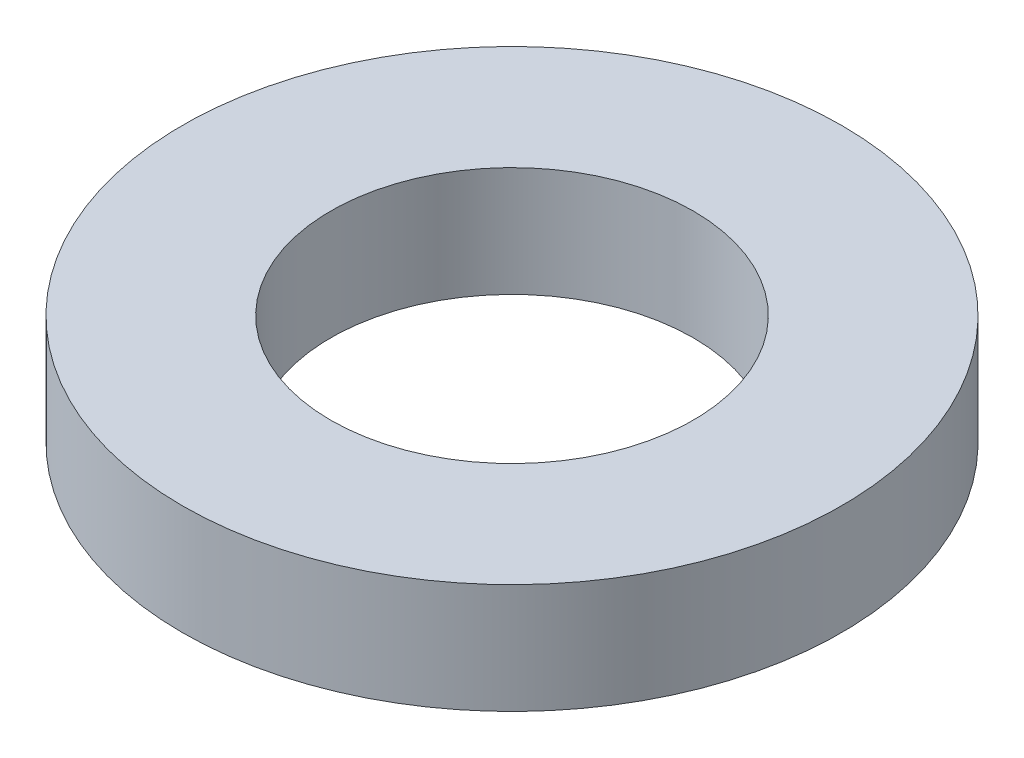
from build123d import *

# Parameters (mm, degrees)
SKETCH_1_R      = 3
SKETCH_1_R_2    = 1.65
EXTRUDE_1_DEPTH = 1


with BuildPart() as part:
    # 草图1 → 凸台-拉伸1 (new body)
    with BuildSketch(Plane(origin=(0, 0, 0), x_dir=(1, 0, 0), z_dir=(0, 1, 0))):
        with Locations(Location((0, 0, 0), (0, 0, 270))):
            Circle(SKETCH_1_R)
        with Locations(Location((0, 0, 0), (0, 0, 270))):
            Circle(SKETCH_1_R_2, mode=Mode.SUBTRACT)
    extrude(amount=EXTRUDE_1_DEPTH)


solid = part.part
